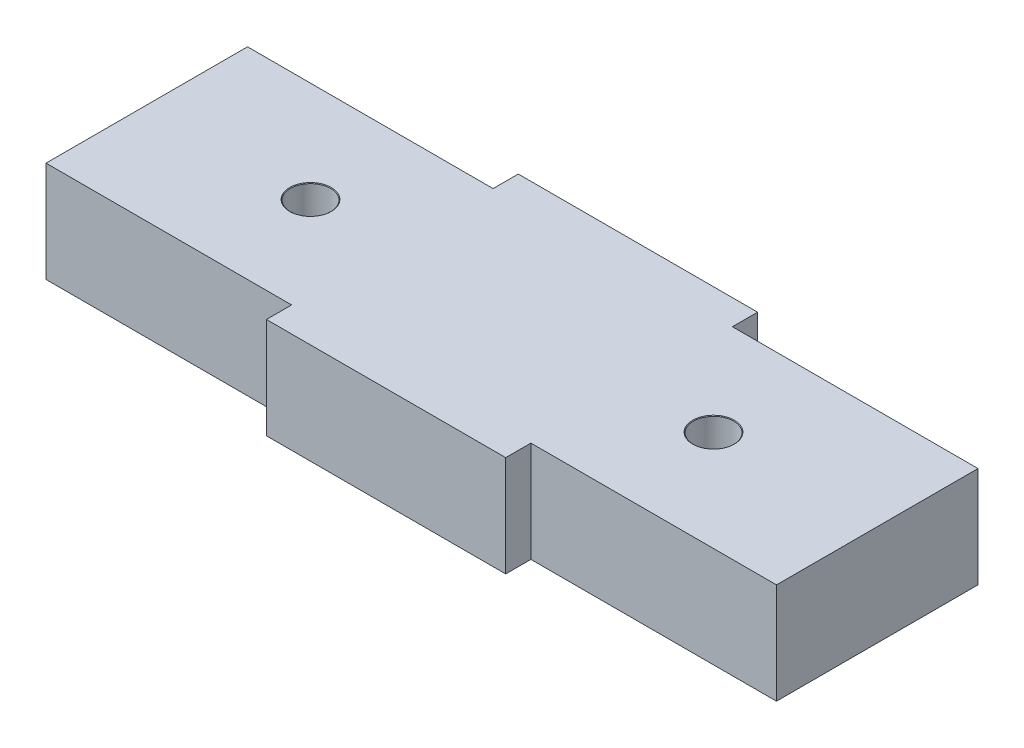
from build123d import *

# Parameters (mm, degrees)
SKETCH1_W                         = 29
SKETCH1_H                         = 8
BOSS_EXTRUDE1_DEPTH               = 4
SKETCH2_W                         = 9.5
SKETCH2_H                         = 4
BOSS_EXTRUDE2_DEPTH               = 1
SKETCH3_W                         = 9.5
SKETCH3_H                         = 4
BOSS_EXTRUDE3_DEPTH               = 1
TAP_DRILL_FOR_M2_TAP1_D           = 1.6
TAP_DRILL_FOR_M2_TAP1_CSINK_D     = 1.65
TAP_DRILL_FOR_M2_TAP1_CSINK_ANGLE = 100


with BuildPart() as part:
    # Sketch1 → Boss-Extrude1 (new body)
    with BuildSketch(Plane(origin=(0, 0, 0), x_dir=(1, 0, 0), z_dir=(0, 1, 0))):
        with Locations((14.5, 4)):
            Rectangle(SKETCH1_W, SKETCH1_H)
    extrude(amount=BOSS_EXTRUDE1_DEPTH)

    # Sketch2 → Boss-Extrude2 (add)
    with BuildSketch(Plane.XY):
        with Locations((14.5, 2)):
            Rectangle(SKETCH2_W, SKETCH2_H)
    extrude(amount=BOSS_EXTRUDE2_DEPTH)

    # Sketch3 → Boss-Extrude3 (add)
    with BuildSketch(Plane(origin=(0, 0, -8), x_dir=(-1, 0, 0), z_dir=(0, 0, -1))):
        with Locations((-14.5, 2)):
            Rectangle(SKETCH3_W, SKETCH3_H)
    extrude(amount=BOSS_EXTRUDE3_DEPTH)

    # Tap Drill for M2 Tap1 (through all)
    with Locations(Plane(origin=(0, 4, 0), x_dir=(1, 0, 0), z_dir=(0, 1, 0))):
        with Locations((6.5, 4), (22.5, 4)):
            CounterSinkHole(TAP_DRILL_FOR_M2_TAP1_D / 2, TAP_DRILL_FOR_M2_TAP1_CSINK_D / 2, counter_sink_angle=TAP_DRILL_FOR_M2_TAP1_CSINK_ANGLE)


solid = part.part
